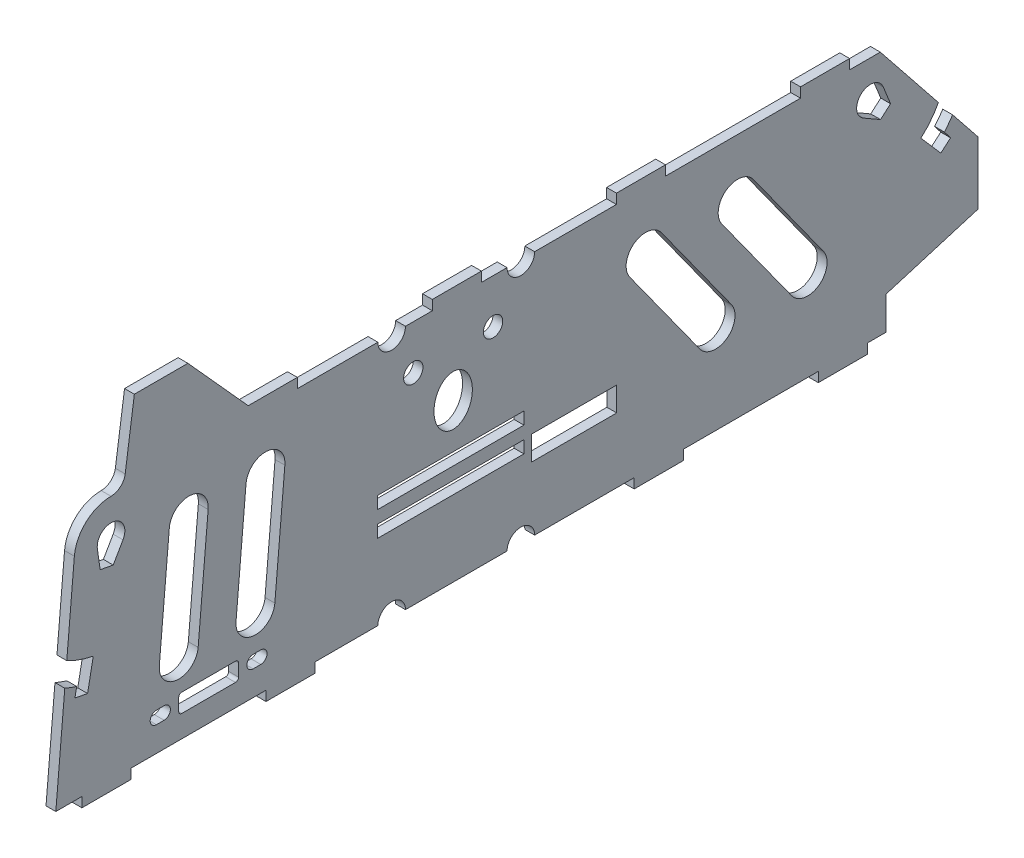
from build123d import *

# Parameters (mm, degrees)
SKETCH_215_W           = 23.879073069
SKETCH_215_H           = 2
SKETCH_215_W_2         = 13.873866224
SKETCH_215_H_2         = 3.944574251
EXTRUDE_1_DEPTH        = 1.6
SKETCH_2_W             = 8
SKETCH_2_H             = 1.6
EXTRUDE_3744_DEPTH     = 1.6
SKETCH_3858_R          = 1.575
SKETCH_3858_RX         = 4.079397779
SKETCH_3858_RY         = 3.125
CUT_EXTRUDE_4259_DEPTH = 111.010448945
CUT_EXTRUDE_4725_DEPTH = 111.010449082
USB_C_DEPTH            = 111.010449082


with BuildPart() as part:
    # Sketch 215 → 凸台-拉伸1 (new body)
    with BuildSketch(Plane(origin=(0, 0, 0), x_dir=(0, 0, -1), z_dir=(1, 0, 0))):
        with BuildLine():
            Line((-95.202576637, 16.678130112), (-96.66172395, 0))
            Line((-96.66172395, 0), (-44.182229478, 0))
            ThreePointArc((-44.182229478, 0), (-41.932229478, 2.25), (-39.682229478, 0))
            Line((-39.682229478, 0), (-23.132229478, 0))
            ThreePointArc((-23.132229478, 0), (-20.882229478, 2.25), (-18.632229478, 0))
            Line((-18.632229478, 0), (38.58827605, 0))
            Line((38.58827605, 0), (38.58827605, 5.363667343))
            Line((38.58827605, 5.363667343), (53.613979238, 9.877821069))
            Line((53.613979238, 9.877821069), (53.613979238, 20.082386187))
            Line((53.613979238, 20.082386187), (49.47062371, 25.265958003))
            ThreePointArc((49.47062371, 25.265958003), (48.834122057, 24.360802519), (48.136507156, 23.501864655))
            Line((48.136507156, 23.501864655), (49.140587437, 22.184380908))
            Line((49.140587437, 22.184380908), (47.555615421, 20.806751165))
            Line((47.555615421, 20.806751165), (46.571594176, 21.938874033))
            Line((46.571594176, 21.938874033), (44.304779315, 24.546859335))
            ThreePointArc((44.304779315, 24.546859335), (45.901319607, 26.216879129), (47.163951689, 28.151735001))
            Line((47.163951689, 28.151735001), (38.58827605, 38.88038965))
            Line((38.58827605, 38.88038965), (37.693344157, 40))
            Line((37.693344157, 40), (-18.632229478, 40))
            ThreePointArc((-18.632229478, 40), (-20.882229478, 37.75), (-23.132229478, 40))
            Line((-23.132229478, 40), (-39.682229478, 40))
            ThreePointArc((-39.682229478, 40), (-41.932229478, 37.75), (-44.182229478, 40))
            Line((-44.182229478, 40), (-87.664190365, 40))
            ThreePointArc((-87.664190365, 40), (-91.717731611, 38.423664021), (-93.641358554, 34.522934456))
            Line((-93.641358554, 34.522934456), (-94.87665585, 20.403421746))
            ThreePointArc((-94.87665585, 20.403421746), (-92.775563539, 19.482408503), (-90.560913042, 18.883929203))
            Line((-90.560913042, 18.883929203), (-91.219638908, 15.446476624))
            Line((-91.219638908, 15.446476624), (-91.483129255, 14.071495593))
            Line((-91.483129255, 14.071495593), (-93.545600802, 14.466731113))
            Line((-93.545600802, 14.466731113), (-93.260074318, 15.956704104))
            ThreePointArc((-93.260074318, 15.956704104), (-94.241224457, 16.290763242), (-95.202576637, 16.678130112))
        make_face()
        with Locations((-32.321766012, 13.338077)):
            Rectangle(SKETCH_215_W, SKETCH_215_H, mode=Mode.SUBTRACT)
        with Locations((-32.321766012, 17.395875517)):
            Rectangle(SKETCH_215_W, SKETCH_215_H, mode=Mode.SUBTRACT)
        with Locations((-12.198657062, 12.527713279)):
            Rectangle(SKETCH_215_W_2, SKETCH_215_H_2, mode=Mode.SUBTRACT)
        with BuildLine():
            Line((-87.309268426, 30.113751112), (-88.369968079, 30.317015094))
            Line((-88.369968079, 30.317015094), (-89.430667732, 30.520279076))
            Line((-89.430667732, 30.520279076), (-89.890653352, 33.675403991))
            ThreePointArc((-89.890653352, 33.675403991), (-87.826914488, 36.244108032), (-85.414190365, 34))
            ThreePointArc((-85.414190365, 34), (-85.490811978, 33.417826153), (-85.715458265, 32.875303062))
            Line((-85.715458265, 32.875303062), (-87.309268426, 30.113751112))
        make_face(mode=Mode.SUBTRACT)
        with BuildLine():
            ThreePointArc((34.968023431, 32.04870964), (34.612244182, 35.698184303), (38.176585209, 34.837534989))
            Line((38.176585209, 34.837534989), (39.363457628, 31.878188125))
            Line((39.363457628, 31.878188125), (38.548329162, 31.169692829))
            Line((38.548329162, 31.169692829), (37.733200697, 30.461197532))
            Line((37.733200697, 30.461197532), (34.968023431, 32.04870964))
        make_face(mode=Mode.SUBTRACT)
    extrude(amount=EXTRUDE_1_DEPTH)

    # 草图2 → Extrude 3744 (add)
    with BuildSketch(Plane(origin=(0, 0, 0), x_dir=(0, 0, -1), z_dir=(1, 0, 0))):
        with Locations((31.58827605, -0.8)):
            Rectangle(SKETCH_2_W, SKETCH_2_H)
        with BuildLine():
            Line((-83.862737476, 52.5), (-85.358986401, 42))
            ThreePointArc((-85.358986401, 42), (-86.138250874, 40.569690448), (-87.664190365, 40))
            Line((-87.664190365, 40), (-65.306655843, 40))
            Line((-65.306655843, 40), (-57.306655843, 40))
            Line((-57.306655843, 40), (-57.306655843, 41.6))
            Line((-57.306655843, 41.6), (-65.306655843, 41.6))
            Line((-65.306655843, 41.6), (-75.139107316, 52.5))
            Line((-75.139107316, 52.5), (-83.862737476, 52.5))
        make_face()
        with Locations((1.58827605, -0.8)):
            Rectangle(SKETCH_2_W, SKETCH_2_H)
        with Locations((-58.41172395, -0.8)):
            Rectangle(SKETCH_2_W, SKETCH_2_H)
        with Locations((-88.41172395, -0.8)):
            Rectangle(SKETCH_2_W, SKETCH_2_H)
        with Locations((28.693344157, 40.8)):
            Rectangle(SKETCH_2_W, SKETCH_2_H)
        with Locations((-1.306655843, 40.8)):
            Rectangle(SKETCH_2_W, SKETCH_2_H)
        with Locations((-31.306655843, 40.8)):
            Rectangle(SKETCH_2_W, SKETCH_2_H)
    extrude(amount=EXTRUDE_3744_DEPTH)

    # Sketch 3858 → Cut-Extrude 4259 (cut, through all)
    with BuildSketch(Plane(origin=(1.6, 0, 0), x_dir=(0, 0, -1), z_dir=(1, 0, 0))):
        with Locations((-38.41172395, 32.797244765)):
            Circle(SKETCH_3858_R)
        with Locations((-25.41172395, 32.797244765)):
            Circle(SKETCH_3858_R)
        with Locations(Location((-31.91172395, 25.645875517), (0, 0, 90))):
            Ellipse(SKETCH_3858_RX, SKETCH_3858_RY)
    extrude(amount=-CUT_EXTRUDE_4259_DEPTH, mode=Mode.SUBTRACT)

    # 草图3 → Cut-Extrude 4725 (cut, through all)
    with BuildSketch(Plane(origin=(1.6, 0, 0), x_dir=(0, 0, -1), z_dir=(1, 0, 0))):
        with BuildLine():
            Line((-71.837081834, 30.223280517), (-73.468745408, 11.573280517))
            ThreePointArc((-73.468745408, 11.573280517), (-76.908383058, 8.687081834), (-79.794581741, 12.126719483))
            Line((-79.794581741, 12.126719483), (-78.162918166, 30.776719483))
            ThreePointArc((-78.162918166, 30.776719483), (-74.723280517, 33.662918166), (-71.837081834, 30.223280517))
        make_face()
        with BuildLine():
            Line((17.026747393, 32.354992688), (28.419615873, 16.52930004))
            ThreePointArc((28.419615873, 16.52930004), (27.697861168, 12.097559959), (23.266121087, 12.819314663))
            Line((23.266121087, 12.819314663), (11.873252607, 28.645007312))
            ThreePointArc((11.873252607, 28.645007312), (12.595007312, 33.076747393), (17.026747393, 32.354992688))
        make_face()
        with BuildLine():
            Line((2.026747393, 32.354992688), (13.419615873, 16.52930004))
            ThreePointArc((13.419615873, 16.52930004), (12.697861168, 12.097559959), (8.266121087, 12.819314663))
            Line((8.266121087, 12.819314663), (-3.126747393, 28.645007312))
            ThreePointArc((-3.126747393, 28.645007312), (-2.404992688, 33.076747393), (2.026747393, 32.354992688))
        make_face()
        with BuildLine():
            Line((-59.337081834, 30.223280517), (-60.968745408, 11.573280517))
            ThreePointArc((-60.968745408, 11.573280517), (-64.408383058, 8.687081834), (-67.294581741, 12.126719483))
            Line((-67.294581741, 12.126719483), (-65.662918166, 30.776719483))
            ThreePointArc((-65.662918166, 30.776719483), (-62.223280517, 33.662918166), (-59.337081834, 30.223280517))
        make_face()
    extrude(amount=-CUT_EXTRUDE_4725_DEPTH, mode=Mode.SUBTRACT)

    # Sketch1 → USB-C供电接口 (cut, through all)
    with BuildSketch(Plane(origin=(0, 0, 0), x_dir=(0, 0, -1), z_dir=(1, 0, 0))):
        with BuildLine():
            Line((-76.136302547, 6.588077), (-67.386302547, 6.588077))
            ThreePointArc((-67.386302547, 6.588077), (-67.032749156, 6.441630391), (-66.886302547, 6.088077))
            Line((-66.886302547, 6.088077), (-66.886302547, 4.088077))
            ThreePointArc((-66.886302547, 4.088077), (-67.032749156, 3.734523609), (-67.386302547, 3.588077))
            Line((-67.386302547, 3.588077), (-76.136302547, 3.588077))
            ThreePointArc((-76.136302547, 3.588077), (-76.489855937, 3.734523609), (-76.636302547, 4.088077))
            Line((-76.636302547, 4.088077), (-76.636302547, 6.088077))
            ThreePointArc((-76.636302547, 6.088077), (-76.489855937, 6.441630391), (-76.136302547, 6.588077))
        make_face()
        with BuildLine():
            Line((-79.011302547, 4.063077), (-80.261302547, 4.063077))
            ThreePointArc((-80.261302547, 4.063077), (-81.286302547, 5.088077), (-80.261302547, 6.113077))
            Line((-80.261302547, 6.113077), (-79.011302547, 6.113077))
            ThreePointArc((-79.011302547, 6.113077), (-77.986302547, 5.088077), (-79.011302547, 4.063077))
        make_face()
        with BuildLine():
            Line((-64.511302547, 4.063077), (-63.261302547, 4.063077))
            ThreePointArc((-63.261302547, 4.063077), (-62.236302547, 5.088077), (-63.261302547, 6.113077))
            Line((-63.261302547, 6.113077), (-64.511302547, 6.113077))
            ThreePointArc((-64.511302547, 6.113077), (-65.536302547, 5.088077), (-64.511302547, 4.063077))
        make_face()
    extrude(amount=USB_C_DEPTH, mode=Mode.SUBTRACT)


solid = part.part
